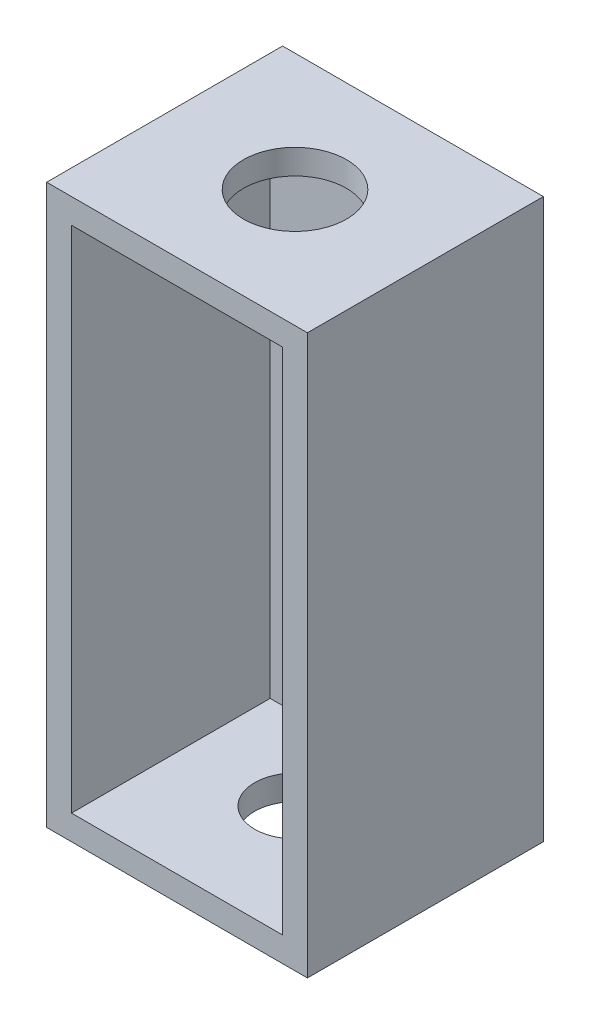
from build123d import *

# Parameters (mm, degrees)
SKETCH_1_W                = 42
SKETCH_1_H                = 90
HOUSING_ENVELOPE_DEPTH    = 38
SKETCH_2_W                = 34
SKETCH_2_H                = 82
FRONT_ACCESS_WINDOW_DEPTH = 32
SKETCH_3_R                = 6.5
AXIAL_PASSAGE_DEPTH       = 107.339080304
SKETCH_4_R                = 8.3
D16_CLEARANCE_DEPTH       = 4.3


with BuildPart() as part:
    # 草图1 → Housing_envelope (new body)
    with BuildSketch(Plane.XY):
        with Locations((21, 45)):
            Rectangle(SKETCH_1_W, SKETCH_1_H)
    extrude(amount=HOUSING_ENVELOPE_DEPTH)

    # 草图2 → Front_access_window (cut)
    with BuildSketch(Plane.XY.offset(38)):
        with Locations((21, 45)):
            Rectangle(SKETCH_2_W, SKETCH_2_H)
    extrude(amount=-FRONT_ACCESS_WINDOW_DEPTH, mode=Mode.SUBTRACT)

    # 草图3 → Axial_passage (cut, through all)
    with BuildSketch(Plane(origin=(0, 90, 0), x_dir=(1, 0, 0), z_dir=(0, 1, 0))):
        with Locations(Location((21, -19, 0), (0, 0, 270))):
            Circle(SKETCH_3_R)
    extrude(amount=-AXIAL_PASSAGE_DEPTH, mode=Mode.SUBTRACT)

    # 草图4 → D16_clearance (cut)
    with BuildSketch(Plane(origin=(0, 90, 0), x_dir=(1, 0, 0), z_dir=(0, 1, 0))):
        with Locations(Location((21, -19, 0), (0, 0, 270))):
            Circle(SKETCH_4_R)
    extrude(amount=-D16_CLEARANCE_DEPTH, mode=Mode.SUBTRACT)


solid = part.part
